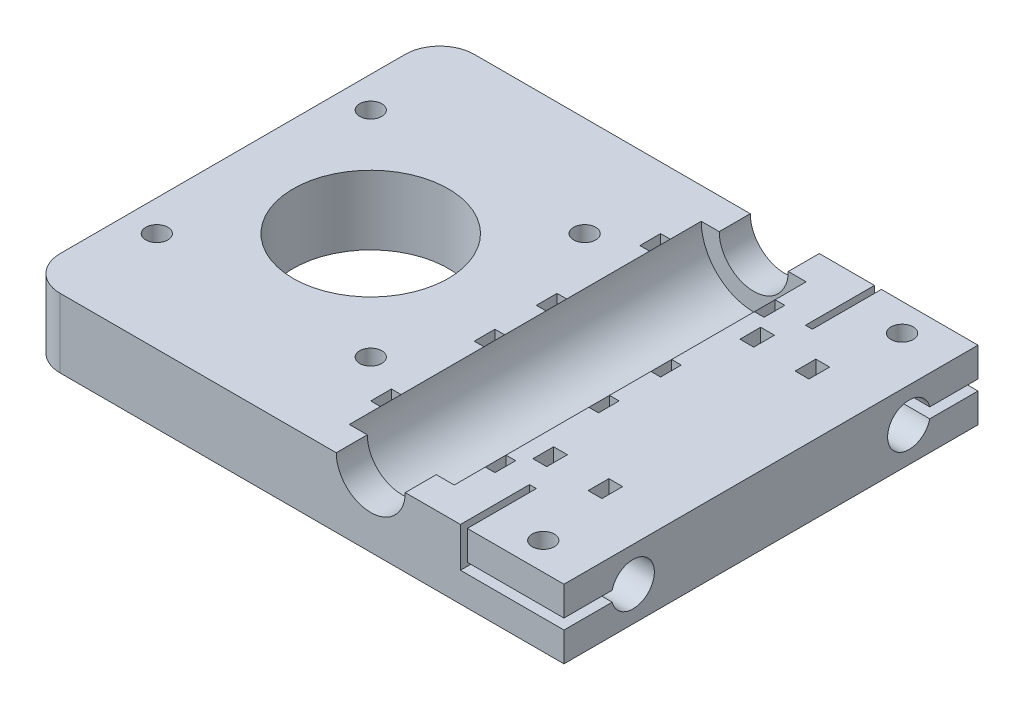
from build123d import *

# Parameters (mm, degrees)
SKETCH_2_W           = 40000
SKETCH_2_H           = 60000
EXTRUDE_1_DEPTH      = 10000
SKETCH_4_R           = 7600
CUT_EXTRUDE_2_DEPTH  = 25500
SKETCH_5_R           = 5000
CUT_EXTRUDE_3_DEPTH  = 40000
SKETCH_6_W           = 2000
SKETCH_6_H           = 3000
CUT_EXTRUDE_4_DEPTH  = 80000
SKETCH_12_W          = 38000
SKETCH_12_H          = 60000
SKETCH_12_R          = 1600
SKETCH_12_R_2        = 11250
EXTRUDE_2_DEPTH      = 10000
SKETCH_13_R          = 3100
CUT_EXTRUDE_6_DEPTH  = 18000
SKETCH_16_W          = 10031.479605139
SKETCH_16_H          = 1500
CUT_EXTRUDE_7_DEPTH  = 15000
CUT_EXTRUDE_8_REACH  = 66062.578
SKETCH_17_W          = 1000
SKETCH_17_H          = 10000
SKETCH_18_R          = 1600
CUT_EXTRUDE_9_DEPTH  = 15000
SKETCH_19_W          = 1400
SKETCH_19_H          = 3000
CUT_EXTRUDE_10_DEPTH = 15000
FILLET_1_R           = 5000
SKETCH_20_W          = 6000
SKETCH_20_H          = 3000
CUT_EXTRUDE_11_DEPTH = 2000
FILLET_2_R           = 1000


with BuildPart() as part:
    # 草圖2 → 填料-伸長1 (new body)
    with BuildSketch(Plane(origin=(0, 0, 0), x_dir=(1, 0, 0), z_dir=(0, 1, 0))):
        Rectangle(SKETCH_2_W, SKETCH_2_H)
    extrude(amount=EXTRUDE_1_DEPTH)

    # 草圖4 → 除料-伸長2 (cut, symmetric)
    with BuildSketch(Plane.XY):
        with Locations((-8000, 10000)):
            Circle(SKETCH_4_R)
    extrude(amount=CUT_EXTRUDE_2_DEPTH, both=True, mode=Mode.SUBTRACT)

    # 草圖5 → 除料-伸長3 (cut, symmetric)
    with BuildSketch(Plane.XY):
        with Locations((-8000, 10000)):
            Circle(SKETCH_5_R)
    extrude(amount=CUT_EXTRUDE_3_DEPTH, both=True, mode=Mode.SUBTRACT)

    # 草圖6 → 除料-伸長4 (cut)
    with BuildSketch(Plane(origin=(0, 10000, 0), x_dir=(1, 0, 0), z_dir=(0, 1, 0))):
        with Locations((11000, -15000)):
            Rectangle(SKETCH_6_W, SKETCH_6_H)
        with Locations((3000, 15000)):
            Rectangle(SKETCH_6_W, SKETCH_6_H)
        with Locations((11000, 15000)):
            Rectangle(SKETCH_6_W, SKETCH_6_H)
        with Locations((3000, -15000)):
            Rectangle(SKETCH_6_W, SKETCH_6_H)
    extrude(amount=-CUT_EXTRUDE_4_DEPTH, mode=Mode.SUBTRACT)

    # 草圖12 → 填料-伸長2 (add)
    with BuildSketch(Plane(origin=(0, 10000, 0), x_dir=(1, 0, 0), z_dir=(0, 1, 0))):
        with Locations((-39000, 0)):
            Rectangle(SKETCH_12_W, SKETCH_12_H)
        with Locations(Location((-53500, 15500, 0), (0, 0, 270))):
            Circle(SKETCH_12_R, mode=Mode.SUBTRACT)
        with Locations(Location((-22500, 15500, 0), (0, 0, 270))):
            Circle(SKETCH_12_R, mode=Mode.SUBTRACT)
        with Locations(Location((-53500, -15500, 0), (0, 0, 270))):
            Circle(SKETCH_12_R, mode=Mode.SUBTRACT)
        with Locations(Location((-22500, -15500, 0), (0, 0, 270))):
            Circle(SKETCH_12_R, mode=Mode.SUBTRACT)
        with Locations(Location((-38000, 0, 0), (0, 0, 270))):
            Circle(SKETCH_12_R_2, mode=Mode.SUBTRACT)
    extrude(amount=-EXTRUDE_2_DEPTH)

    # 草圖13 → 除料-伸長6 (cut)
    with BuildSketch(Plane(origin=(20000, 0, 0), x_dir=(0, 0, -1), z_dir=(1, 0, 0))):
        with Locations((-20000, 5000)):
            Circle(SKETCH_13_R)
        with Locations(Location((20000, 5000, 0), (0, 0, 180))):
            Circle(SKETCH_13_R)
    extrude(amount=-CUT_EXTRUDE_6_DEPTH, mode=Mode.SUBTRACT)

    # 草圖16 → 除料-伸長7 (cut)
    with BuildSketch(Plane(origin=(20000, 0, 0), x_dir=(0, 0, -1), z_dir=(1, 0, 0))):
        with Locations((-26040.217814772, 5000)):
            Rectangle(SKETCH_16_W, SKETCH_16_H)
        with Locations((26040.217814772, 5000)):
            Rectangle(SKETCH_16_W, SKETCH_16_H)
    extrude(amount=-CUT_EXTRUDE_7_DEPTH, mode=Mode.SUBTRACT)

    # 除料-伸長8: up to this face of the body (flat: up to its plane)
    cut_extrude_8_end = Plane(part.part.faces().sort_by_distance((12500, 4250, -26503.95312427))[0])
    # 草圖17 → 除料-伸長8 (cut, up to the picked face)
    with BuildSketch(Plane(origin=(0, 10000, 0), x_dir=(1, 0, 0), z_dir=(0, 1, 0)), mode=Mode.PRIVATE) as cut_extrude_8_sk1:
        with Locations((5500, 25000)):
            Rectangle(SKETCH_17_W, SKETCH_17_H)
    cut_extrude_8_tool1 = split(extrude(cut_extrude_8_sk1.sketch, amount=-CUT_EXTRUDE_8_REACH, mode=Mode.PRIVATE), bisect_by=cut_extrude_8_end, keep=Keep.BOTH, mode=Mode.PRIVATE)
    # 草圖17 → 除料-伸長8 (cut, up to the picked face)
    with BuildSketch(Plane(origin=(0, 10000, 0), x_dir=(1, 0, 0), z_dir=(0, 1, 0)), mode=Mode.PRIVATE) as cut_extrude_8_sk2:
        with Locations((5500, -25000)):
            Rectangle(SKETCH_17_W, SKETCH_17_H)
    cut_extrude_8_tool2 = split(extrude(cut_extrude_8_sk2.sketch, amount=-CUT_EXTRUDE_8_REACH, mode=Mode.PRIVATE), bisect_by=cut_extrude_8_end, keep=Keep.BOTH, mode=Mode.PRIVATE)
    add(cut_extrude_8_tool1.solids().sort_by(Axis((5500, 10000, -25000), (0, -1, 0)))[0], mode=Mode.SUBTRACT)
    add(cut_extrude_8_tool2.solids().sort_by(Axis((5500, 10000, 25000), (0, -1, 0)))[0], mode=Mode.SUBTRACT)

    # 草圖18 → 除料-伸長9 (cut)
    with BuildSketch(Plane(origin=(0, 10000, 0), x_dir=(1, 0, 0), z_dir=(0, 1, 0))):
        with Locations(Location((13000, 26000, 0), (0, 0, 270))):
            Circle(SKETCH_18_R)
        with Locations(Location((13000, -26000, 0), (0, 0, 270))):
            Circle(SKETCH_18_R)
    extrude(amount=-CUT_EXTRUDE_9_DEPTH, mode=Mode.SUBTRACT)

    # 草圖19 → 除料-伸長10 (cut)
    with BuildSketch(Plane(origin=(0, 10000, 0), x_dir=(1, 0, 0), z_dir=(0, 1, 0))):
        with Locations((-16300, 19500)):
            Rectangle(SKETCH_19_W, SKETCH_19_H)
        with Locations((-16300, 4500)):
            Rectangle(SKETCH_19_W, SKETCH_19_H)
        with Locations((-16300, -4500)):
            Rectangle(SKETCH_19_W, SKETCH_19_H)
        with Locations((-16300, -19500)):
            Rectangle(SKETCH_19_W, SKETCH_19_H)
        with Locations((300, -19500)):
            Rectangle(SKETCH_19_W, SKETCH_19_H)
        with Locations((300, -4500)):
            Rectangle(SKETCH_19_W, SKETCH_19_H)
        with Locations((300, 4500)):
            Rectangle(SKETCH_19_W, SKETCH_19_H)
        with Locations((300, 19500)):
            Rectangle(SKETCH_19_W, SKETCH_19_H)
    extrude(amount=-CUT_EXTRUDE_10_DEPTH, mode=Mode.SUBTRACT)

    # 圓角1
    fillet_1_edges = [part.edges().sort_by_distance(p)[0] for p in [
        (-58000, 5000, 30000),
        (-58000, 5000, -30000),
    ]]
    fillet(fillet_1_edges, radius=FILLET_1_R)

    # 草圖20 → 除料-伸長11 (cut)
    with BuildSketch(Plane.XZ):
        with Locations((7000, 15000)):
            Rectangle(SKETCH_20_W, SKETCH_20_H)
        with Locations((7000, -15000)):
            Rectangle(SKETCH_20_W, SKETCH_20_H)
    extrude(amount=-CUT_EXTRUDE_11_DEPTH, mode=Mode.SUBTRACT)

    # 圓角2
    fillet_2_edges = [part.edges().sort_by_distance(p)[0] for p in [
        (4000, 2000, 15000),
        (10000, 2000, 15000),
        (4000, 2000, -15000),
        (10000, 2000, -15000),
    ]]
    fillet(fillet_2_edges, radius=FILLET_2_R)


solid = part.part
